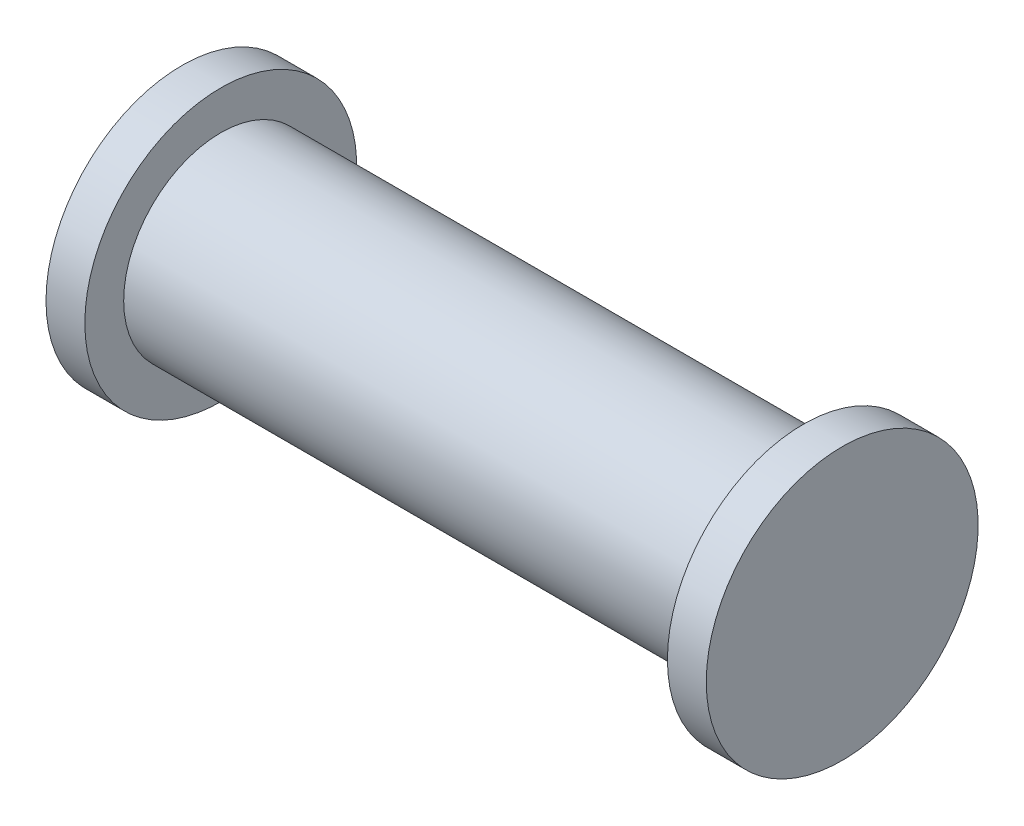
from build123d import *


with BuildPart() as part:
    # Sketch1 → Revolve1 (revolve)
    with BuildSketch(Plane.XY, mode=Mode.PRIVATE) as revolve1_sk:
        Polygon((-15, 5), (15, 5), (15, 7), (17, 7), (17, 0), (-17, 0), (-17, 7), (-15, 7), align=None)
    revolve(revolve1_sk.sketch.rotate(Axis((-17, 0, 0), (1, 0, 0)), 90), axis=Axis((-17, 0, 0), (1, 0, 0)))


solid = part.part
